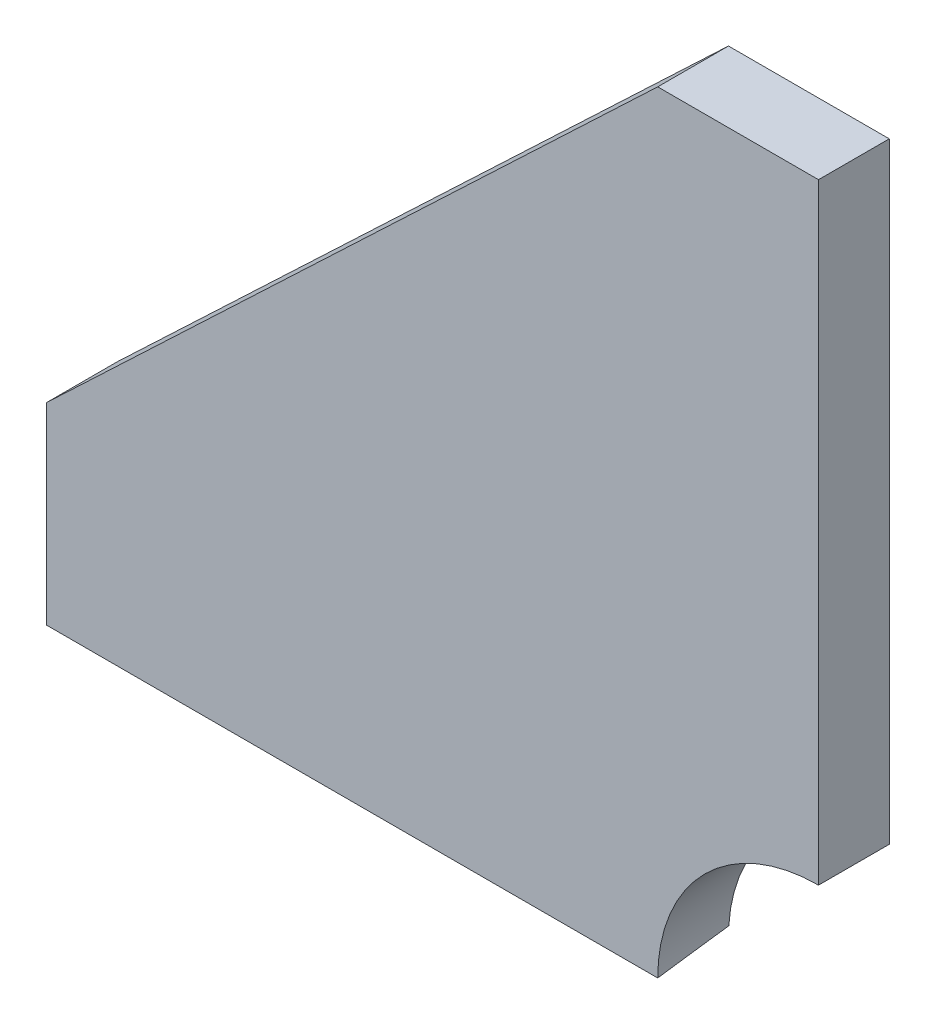
from build123d import *

# Parameters (mm, degrees)
BOSS_EXTRUDE1_DEPTH = 11
CUT_EXTRUDE1_DEPTH  = 114


with BuildPart() as part:
    # Sketch1 → Boss-Extrude1 (new body)
    with BuildSketch(Plane.XY):
        with BuildLine():
            Line((25, 0), (0, 0))
            Line((0, 0), (-95, -90))
            Line((-95, -90), (-95, -120))
            Line((-95, -120), (0, -120))
            ThreePointArc((0, -120), (7.32233047, -102.32233047), (25, -95))
            Line((25, -95), (25, 0))
        make_face()
    extrude(amount=BOSS_EXTRUDE1_DEPTH)

    # Sketch2 → Cut-Extrude1 (cut)
    with BuildSketch(Plane.ZY.offset(95)):
        Polygon((0, -120), (0, -118.454050818), (11, -120), align=None)
    extrude(amount=-CUT_EXTRUDE1_DEPTH, mode=Mode.SUBTRACT)


solid = part.part
